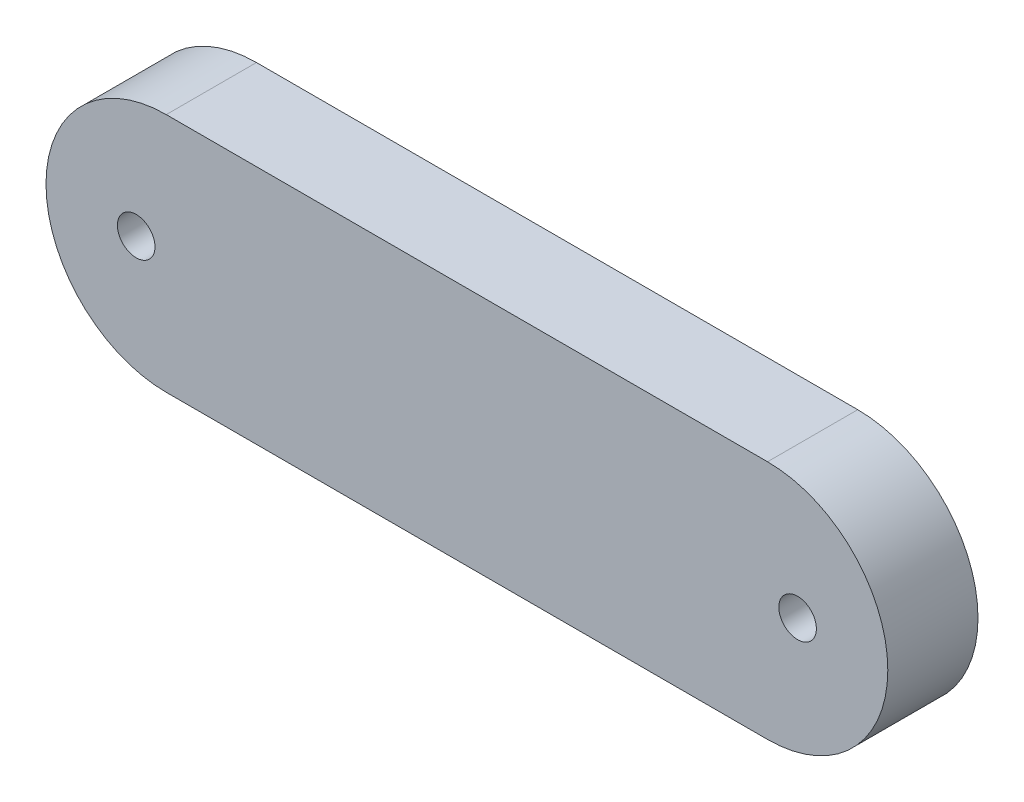
from build123d import *

# Parameters (mm, degrees)
SKETCH1_R           = 3.96875
BOSS_EXTRUDE1_DEPTH = 9.525


with BuildPart() as part:
    # Sketch1 → Boss-Extrude1 (new, symmetric)
    with BuildSketch(Plane.XY):
        with BuildLine():
            Line((-63.5, -25.4), (63.5, -25.4))
            ThreePointArc((63.5, -25.4), (88.9, 0), (63.5, 25.4))
            Line((63.5, 25.4), (-63.5, 25.4))
            ThreePointArc((-63.5, 25.4), (-88.9, 0), (-63.5, -25.4))
        make_face()
        with Locations(Location((-69.85, 0, 0), (0, 0, 180))):
            Circle(SKETCH1_R, mode=Mode.SUBTRACT)
        with Locations(Location((69.85, 0, 0), (0, 0, 180))):
            Circle(SKETCH1_R, mode=Mode.SUBTRACT)
    extrude(amount=BOSS_EXTRUDE1_DEPTH, both=True)


solid = part.part
